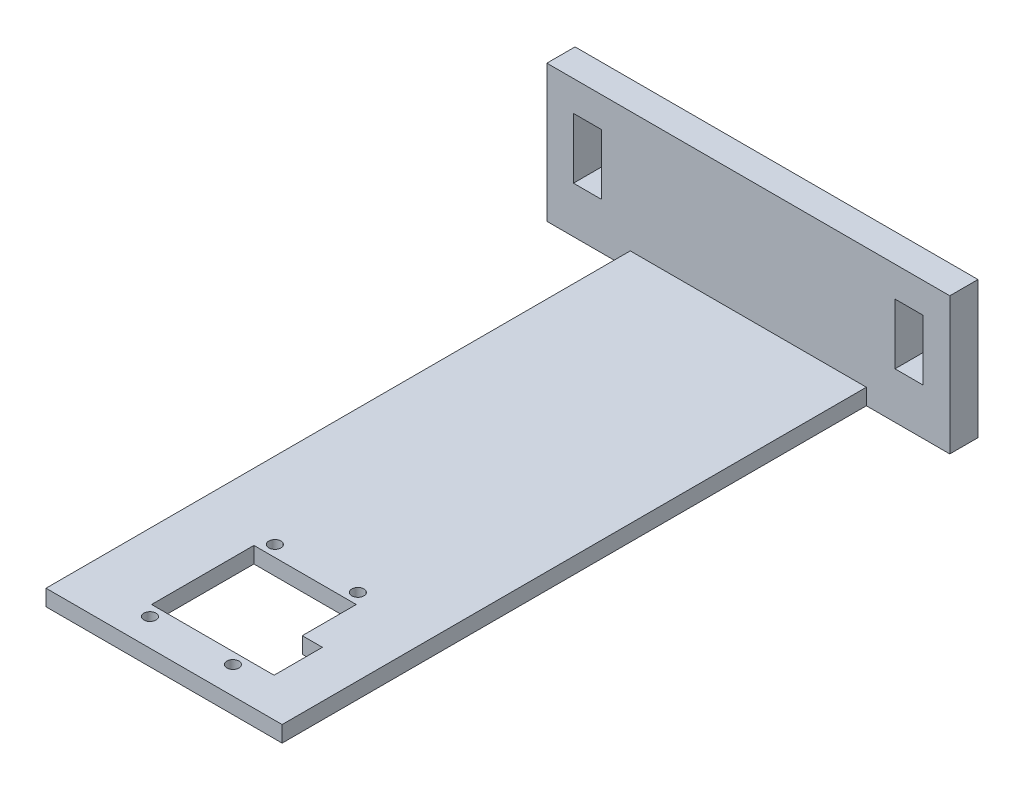
from build123d import *

# Parameters (mm, degrees)
SKETCH1_W           = 100
SKETCH1_H           = 152
BOSS_EXTRUDE1_DEPTH = 34
SKETCH2_W           = 100
SKETCH2_H           = 145
CUT_EXTRUDE1_DEPTH  = 30
SKETCH3_W           = 7
SKETCH3_H           = 15
CUT_EXTRUDE2_DEPTH  = 158.101877774
SKETCH4_W           = 20.7
SKETCH4_H           = 145
CUT_EXTRUDE3_DEPTH  = 96.791440119
SKETCH5_W           = 25.4
SKETCH5_H           = 25.4
CUT_EXTRUDE4_DEPTH  = 96.791440119
SKETCH7_R           = 1.5
CUT_EXTRUDE5_DEPTH  = 96.791440119
SKETCH8_W           = 5
SKETCH8_H           = 12
CUT_EXTRUDE6_DEPTH  = 96.791440119


with BuildPart() as part:
    # Sketch1 → Boss-Extrude1 (new body)
    with BuildSketch(Plane(origin=(0, 0, 0), x_dir=(1, 0, 0), z_dir=(0, 1, 0))):
        Rectangle(SKETCH1_W, SKETCH1_H)
    extrude(amount=BOSS_EXTRUDE1_DEPTH)

    # Sketch2 → Cut-Extrude1 (cut)
    with BuildSketch(Plane(origin=(0, 34, 0), x_dir=(1, 0, 0), z_dir=(0, 1, 0))):
        with Locations((0, -3.5)):
            Rectangle(SKETCH2_W, SKETCH2_H)
    extrude(amount=-CUT_EXTRUDE1_DEPTH, mode=Mode.SUBTRACT)

    # Sketch3 → Cut-Extrude2 (cut, through all)
    with BuildSketch(Plane.XY.offset(-69)):
        with Locations((-39.9, 19)):
            Rectangle(SKETCH3_W, SKETCH3_H)
        with Locations((39.9, 19)):
            Rectangle(SKETCH3_W, SKETCH3_H)
    extrude(amount=-CUT_EXTRUDE2_DEPTH, mode=Mode.SUBTRACT)

    # Sketch4 → Cut-Extrude3 (cut, through all)
    with BuildSketch(Plane(origin=(0, 4, 0), x_dir=(1, 0, 0), z_dir=(0, 1, 0))):
        with Locations((-39.65, -3.5)):
            Rectangle(SKETCH4_W, SKETCH4_H)
        with Locations((39.65, -3.5)):
            Rectangle(SKETCH4_W, SKETCH4_H)
    extrude(amount=-CUT_EXTRUDE3_DEPTH, mode=Mode.SUBTRACT)

    # Sketch5 → Cut-Extrude4 (cut, through all)
    with BuildSketch(Plane(origin=(0, 4, 0), x_dir=(1, 0, 0), z_dir=(0, 1, 0))):
        with Locations((0, -53.7)):
            Rectangle(SKETCH5_W, SKETCH5_H)
    extrude(amount=-CUT_EXTRUDE4_DEPTH, mode=Mode.SUBTRACT)

    # Sketch7 → Cut-Extrude5 (cut, through all)
    with BuildSketch(Plane(origin=(0, 4, 0), x_dir=(1, 0, 0), z_dir=(0, 1, 0))):
        with Locations(Location((-10.3, -38.2, 0), (0, 0, 270))):
            Circle(SKETCH7_R)
        with Locations(Location((10.3, -38.2, 0), (0, 0, 270))):
            Circle(SKETCH7_R)
        with Locations(Location((10.3, -69.2, 0), (0, 0, 270))):
            Circle(SKETCH7_R)
        with Locations(Location((-10.3, -69.2, 0), (0, 0, 270))):
            Circle(SKETCH7_R)
    extrude(amount=-CUT_EXTRUDE5_DEPTH, mode=Mode.SUBTRACT)

    # Sketch8 → Cut-Extrude6 (cut, through all)
    with BuildSketch(Plane(origin=(0, 4, 0), x_dir=(1, 0, 0), z_dir=(0, 1, 0))):
        with Locations((15.2, -60.4)):
            Rectangle(SKETCH8_W, SKETCH8_H)
    extrude(amount=-CUT_EXTRUDE6_DEPTH, mode=Mode.SUBTRACT)


solid = part.part
